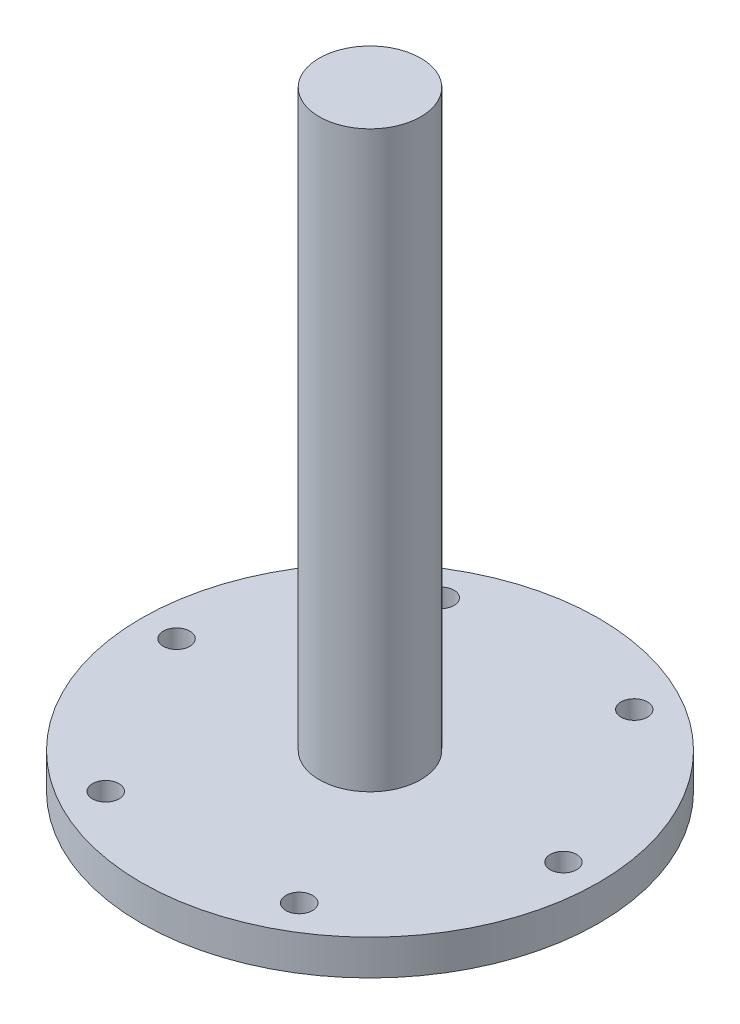
from build123d import *

# Parameters (mm, degrees)
CUT_EXTRUDE_1_DEPTH      = 75.609784881
CUT_EXTRUDE_1_DEPTH_BACK = 75.609784881
SKETCH_2_R               = 1.5


with BuildPart() as part:
    # Эскиз1 → Повернуть1 (revolve)
    with BuildSketch(Plane.XY, mode=Mode.PRIVATE) as revolve_1_sk:
        Polygon((5.75, 0), (25.9, 0), (25.9, -4), (0, -4), (0, 65), (5.75, 65), align=None)
    revolve(revolve_1_sk.sketch.rotate(Axis((0, 0, 0), (0, 1, 0)), 90), axis=Axis((0, 0, 0), (0, 1, 0)))

    # Эскиз2 → Вырез-Вытянуть1 (cut, two sides: drawn at the far end of the back side and taken through both)
    with BuildSketch(Plane(origin=(0, 0, 0), x_dir=(1, 0, 0), z_dir=(0, 1, 0)).offset(-CUT_EXTRUDE_1_DEPTH_BACK)):
        with Locations(Location((21.9, 0, 0), (0, 0, 270))):
            Circle(SKETCH_2_R)
        with Locations(Location((10.95, -18.965956343, 0), (0, 0, 270))):
            Circle(SKETCH_2_R)
        with Locations(Location((-10.95, -18.965956343, 0), (0, 0, 270))):
            Circle(SKETCH_2_R)
        with Locations(Location((-21.9, 0, 0), (0, 0, 270))):
            Circle(SKETCH_2_R)
        with Locations(Location((-10.95, 18.965956343, 0), (0, 0, 270))):
            Circle(SKETCH_2_R)
        with Locations(Location((10.95, 18.965956343, 0), (0, 0, 270))):
            Circle(SKETCH_2_R)
    extrude(amount=CUT_EXTRUDE_1_DEPTH + CUT_EXTRUDE_1_DEPTH_BACK, mode=Mode.SUBTRACT)


solid = part.part
